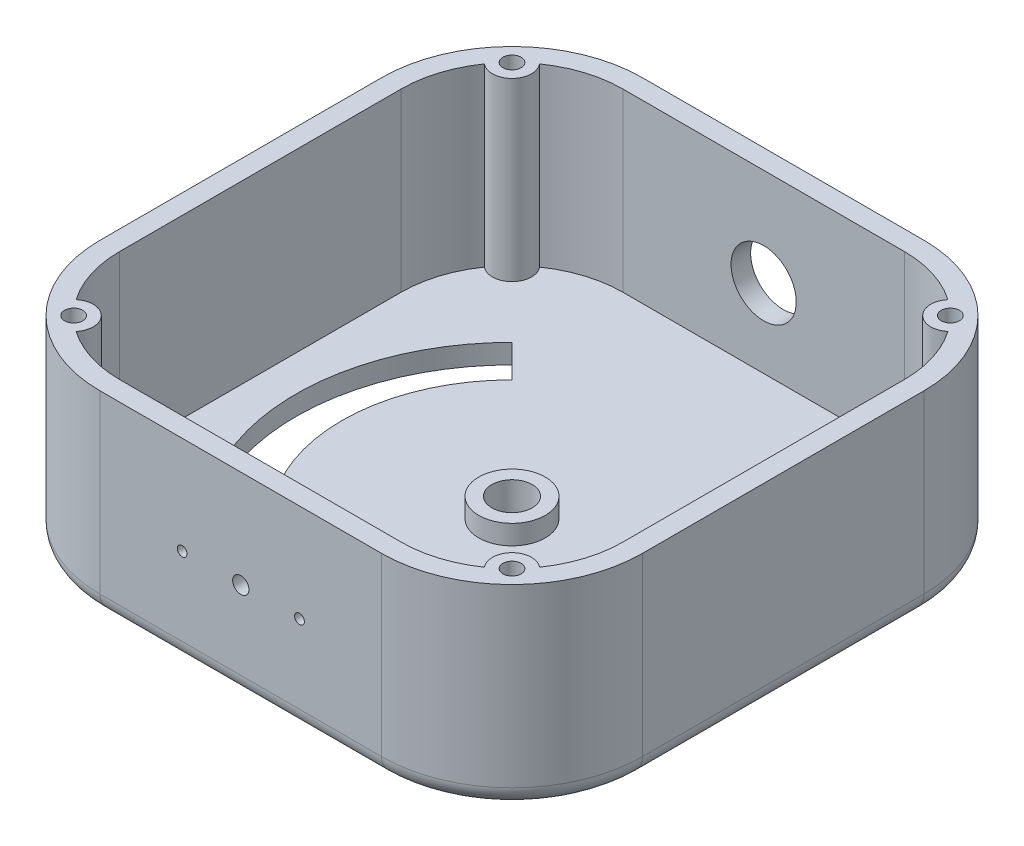
from build123d import *
from build123d.topology import SkipClean

# Parameters (mm, degrees)
SKETCH1_W           = 83.2
SKETCH1_H           = 83.2
BOSS_EXTRUDE1_DEPTH = 30
FILLET1_R           = 20
SHELL2_T            = -3
SKETCH2_R           = 1.25
SKETCH2_R_2         = 0.75
CUT_EXTRUDE1_DEPTH  = 30
SKETCH3_R           = 5
CUT_EXTRUDE2_DEPTH  = 30
SKETCH4_R           = 3.1
CUT_EXTRUDE3_DEPTH  = 30
CUT_EXTRUDE4_DEPTH  = 1.2
SKETCH6_R           = 5.1
SKETCH6_R_2         = 3.1
BOSS_EXTRUDE2_DEPTH = 3
SKETCH7_R           = 3
BOSS_EXTRUDE3_DEPTH = 27
SKETCH9_R           = 1.4
CUT_EXTRUDE5_DEPTH  = 27
FILLET2_R           = 3


with BuildPart() as part:
    # Sketch1 → Boss-Extrude1 (new body)
    with BuildSketch(Plane(origin=(0, 0, 0), x_dir=(1, 0, 0), z_dir=(0, 1, 0))):
        with Locations((-19.461988304, -3.284210526)):
            Rectangle(SKETCH1_W, SKETCH1_H)
    extrude(amount=BOSS_EXTRUDE1_DEPTH)

    # Fillet1
    fillet1_edges = [part.edges().sort_by_distance(p)[0] for p in [
        (-61.061988304, 15, -38.315789474),
        (22.138011696, 15, -38.315789474),
        (22.138011696, 15, 44.884210526),
        (-61.061988304, 15, 44.884210526),
    ]]
    fillet(fillet1_edges, radius=FILLET1_R)

    # Shell2
    shell2_openings = [part.faces().sort_by_distance(p)[0] for p in [
        (-19.461988304, 30, 3.284210526),
    ]]
    offset(amount=SHELL2_T, openings=shell2_openings, kind=Kind.INTERSECTION)

    # Sketch2 → Cut-Extrude1 (cut)
    with BuildSketch(Plane.XY.offset(44.884210526)):
        with Locations((-19.461988304, 15)):
            Circle(SKETCH2_R)
        with Locations((-10.461988304, 15)):
            Circle(SKETCH2_R_2)
        with Locations((-28.461988304, 15)):
            Circle(SKETCH2_R_2)
    extrude(amount=-CUT_EXTRUDE1_DEPTH, mode=Mode.SUBTRACT)

    # Sketch3 → Cut-Extrude2 (cut)
    with BuildSketch(Plane(origin=(0, 0, -38.315789474), x_dir=(-1, 0, 0), z_dir=(0, 0, -1))):
        with Locations((19.461988304, 15)):
            Circle(SKETCH3_R)
    extrude(amount=-CUT_EXTRUDE2_DEPTH, mode=Mode.SUBTRACT)

    # Sketch4 → Cut-Extrude3 (cut)
    with BuildSketch(Plane.XZ):
        with BuildLine():
            ThreePointArc((13.688011696, 3.284210526), (11.164618199, 15.970166309), (3.978601492, 26.724800323))
            Line((3.978601492, 26.724800323), (-1.006501315, 21.739697515))
            ThreePointArc((-1.006501315, 21.739697515), (4.651267494, 13.272248111), (6.638011696, 3.284210526))
            ThreePointArc((6.638011696, 3.284210526), (4.651267494, -6.703827058), (-1.006501315, -15.171276463))
            Line((-1.006501315, -15.171276463), (3.978601492, -20.15637927))
            ThreePointArc((3.978601492, -20.15637927), (11.164618199, -9.401745257), (13.688011696, 3.284210526))
        make_face()
        with BuildLine():
            Line((-37.917475293, 21.739697515), (-42.9025781, 26.724800323))
            ThreePointArc((-42.9025781, 26.724800323), (-52.611988304, 3.284210526), (-42.9025781, -20.15637927))
            Line((-42.9025781, -20.15637927), (-37.917475293, -15.171276463))
            ThreePointArc((-37.917475293, -15.171276463), (-45.561988304, 3.284210526), (-37.917475293, 21.739697515))
        make_face()
        with Locations(Location((-19.461988304, 3.284210526, 0), (0, 0, 270))):
            Circle(SKETCH4_R)
    extrude(amount=-CUT_EXTRUDE3_DEPTH, mode=Mode.SUBTRACT)

    # Sketch5 → Cut-Extrude4 (cut)
    with SkipClean():  # the faces are left unmerged after this step: merging them gives an invalid solid
        with BuildSketch(Plane.XZ):
            with BuildLine():
                Line((-42.9025781, 26.724800323), (-37.917475293, 21.739697515))
                ThreePointArc((-37.917475293, 21.739697515), (-19.461988304, 29.384210526), (-1.006501315, 21.739697515))
                Line((-1.006501315, 21.739697515), (3.978601492, 26.724800323))
                ThreePointArc((3.978601492, 26.724800323), (-19.461988304, 36.434210526), (-42.9025781, 26.724800323))
            make_face()
            with BuildLine():
                Line((-1.006501315, -15.171276463), (3.978601492, -20.15637927))
                ThreePointArc((3.978601492, -20.15637927), (-19.461988304, -29.865789474), (-42.9025781, -20.15637927))
                Line((-42.9025781, -20.15637927), (-37.917475293, -15.171276463))
                ThreePointArc((-37.917475293, -15.171276463), (-19.461988304, -22.815789474), (-1.006501315, -15.171276463))
            make_face()
        extrude(amount=-CUT_EXTRUDE4_DEPTH, mode=Mode.SUBTRACT)

    # Sketch6 → Boss-Extrude2 (add)
    with SkipClean():  # the faces are left unmerged after this step: merging them gives an invalid solid
        with BuildSketch(Plane(origin=(0, 3, 0), x_dir=(1, 0, 0), z_dir=(0, 1, 0))):
            with Locations(Location((-19.461988304, -3.284210526, 0), (0, 0, 270))):
                Circle(SKETCH6_R)
            with Locations(Location((-19.461988304, -3.284210526, 0), (0, 0, 90))):
                Circle(SKETCH6_R_2, mode=Mode.SUBTRACT)
        extrude(amount=BOSS_EXTRUDE2_DEPTH)

    # Sketch7 → Boss-Extrude3 (add)
    with SkipClean():  # the faces are left unmerged after this step: merging them gives an invalid solid
        with BuildSketch(Plane(origin=(0, 3, 0), x_dir=(1, 0, 0), z_dir=(0, 1, 0))):
            with Locations((-53.082803584, 30.336604754)):
                Circle(SKETCH7_R)
            with Locations((-53.082803584, -36.905025806)):
                Circle(SKETCH7_R)
            with Locations((14.158826976, -36.905025806)):
                Circle(SKETCH7_R)
            with Locations((14.158826976, 30.336604754)):
                Circle(SKETCH7_R)
        extrude(amount=BOSS_EXTRUDE3_DEPTH)

    # Sketch9 → Cut-Extrude5 (cut)
    with SkipClean():  # the faces are left unmerged after this step: merging them gives an invalid solid
        with BuildSketch(Plane(origin=(0, 30, 0), x_dir=(1, 0, 0), z_dir=(0, 1, 0))):
            with Locations(Location((-53.082803584, 30.336604754, 0), (0, 0, 270))):
                Circle(SKETCH9_R)
            with Locations(Location((14.158826976, 30.336604754, 0), (0, 0, 270))):
                Circle(SKETCH9_R)
            with Locations(Location((14.158826976, -36.905025806, 0), (0, 0, 270))):
                Circle(SKETCH9_R)
            with Locations(Location((-53.082803584, -36.905025806, 0), (0, 0, 270))):
                Circle(SKETCH9_R)
        extrude(amount=-CUT_EXTRUDE5_DEPTH, mode=Mode.SUBTRACT)

    # Fillet2
    fillet2_edges = [part.edges().sort_by_distance(p)[0] for p in [
        (22.138011696, 0, 3.284210526),
        (-61.061988304, 0, 3.284210526),
        (-19.461988304, 0, -38.315789474),
        (-19.461988304, 0, 44.884210526),
        (-55.204123928, 0, 39.02634615),
        (-55.204123928, 0, -32.457925097),
        (16.28014732, 0, -32.457925097),
        (16.28014732, 0, 39.02634615),
    ]]
    fillet(fillet2_edges, radius=FILLET2_R)


solid = part.part
